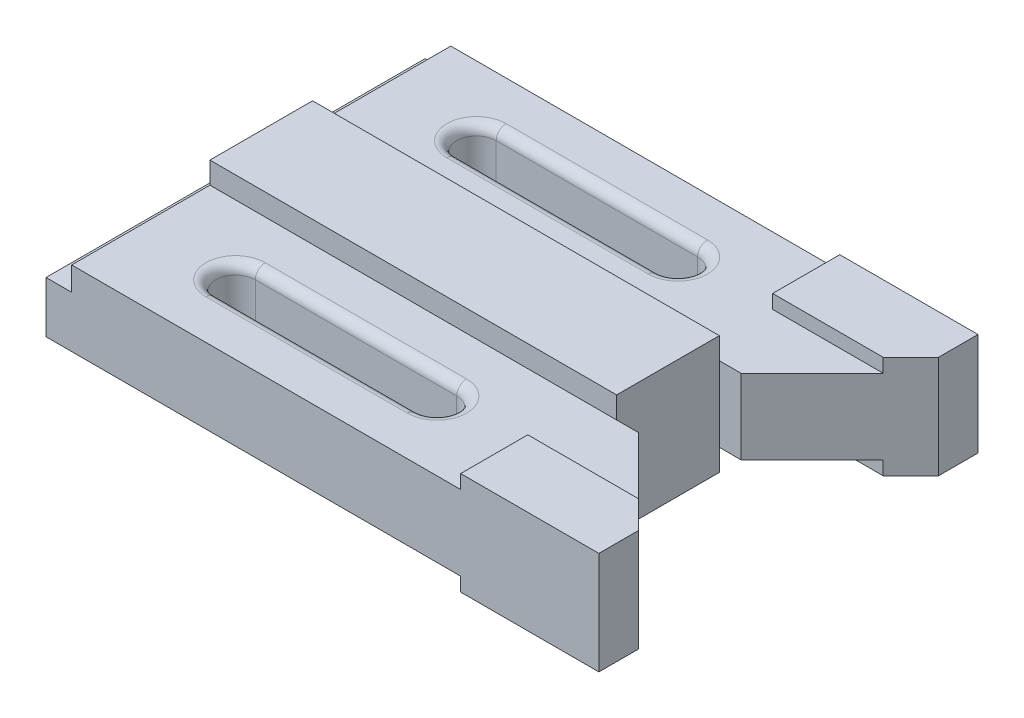
from build123d import *

# Parameters (mm, degrees)
SKETCH1_W           = 109.5
SKETCH1_H           = 26
BOSS_EXTRUDE2_DEPTH = 15
BOSS_EXTRUDE5_DEPTH = 9.5
BOSS_EXTRUDE6_DEPTH = 13
SKETCH2_W           = 6.5
SKETCH2_H           = 11.5
CUT_EXTRUDE1_DEPTH  = 171.414201286
FILLET1_R           = 2.5


with BuildPart() as part:
    # Sketch1 → Boss-Extrude2 (new, symmetric)
    with BuildSketch(Plane(origin=(0, 0, 0), x_dir=(1, 0, 0), z_dir=(0, 1, 0))):
        with Locations((54.75, 0)):
            Rectangle(SKETCH1_W, SKETCH1_H)
    extrude(amount=BOSS_EXTRUDE2_DEPTH, both=True)

    # Sketch1<6> → Boss-Extrude5 (add, symmetric)
    # profile 1 of 2: a face of its own
    with BuildSketch(Plane(origin=(0, 0, 0), x_dir=(1, 0, 0), z_dir=(0, 1, 0))):
        Polygon((0, -30.5), (0, -48), (105, -48), (105, -31), (133, -31), (115, -13), (0, -13), align=None)
        with BuildLine():
            ThreePointArc((30.5, -35.5), (26.964466094, -34.035533906), (25.5, -30.5))
            ThreePointArc((25.5, -30.5), (26.964466094, -26.964466094), (30.5, -25.5))
            Line((30.5, -25.5), (81.5, -25.5))
            ThreePointArc((81.5, -25.5), (86.5, -30.5), (81.5, -35.5))
            Line((81.5, -35.5), (30.5, -35.5))
        make_face(mode=Mode.SUBTRACT)
    # profile 2 of 2: a face of its own
    with BuildSketch(Plane(origin=(0, 0, 0), x_dir=(1, 0, 0), z_dir=(0, 1, 0))):
        Polygon((0, 30.5), (0, 13), (115, 13), (133, 31), (105, 31), (105, 48), (0, 48), align=None)
        with BuildLine():
            ThreePointArc((30.5, 25.5), (26.964466094, 26.964466094), (25.5, 30.5))
            ThreePointArc((25.5, 30.5), (26.964466094, 34.035533906), (30.5, 35.5))
            Line((30.5, 35.5), (81.5, 35.5))
            ThreePointArc((81.5, 35.5), (86.5, 30.5), (81.5, 25.5))
            Line((81.5, 25.5), (30.5, 25.5))
        make_face(mode=Mode.SUBTRACT)
    extrude(amount=BOSS_EXTRUDE5_DEPTH, both=True)

    # Sketch1<7> → Boss-Extrude6 (add, symmetric)
    with BuildSketch(Plane(origin=(0, 0, 0), x_dir=(1, 0, 0), z_dir=(0, 1, 0))):
        Polygon((105, -31), (105, -48), (140, -48), (140, -38), (133, -31), align=None)
        Polygon((140, 48), (105, 48), (105, 31), (133, 31), (140, 38), align=None)
    extrude(amount=BOSS_EXTRUDE6_DEPTH, both=True)

    # Sketch2 → Cut-Extrude1 (cut, through all)
    with BuildSketch(Plane(origin=(0, 0, -48), x_dir=(-1, 0, 0), z_dir=(0, 0, -1))):
        with Locations((-3.25, 9.25)):
            Rectangle(SKETCH2_W, SKETCH2_H)
    extrude(amount=-CUT_EXTRUDE1_DEPTH, mode=Mode.SUBTRACT)

    # Fillet1
    fillet1_edges = [part.edges().sort_by_distance(p)[0] for p in [
        (56, 9.5, 25.5),
        (56, -9.5, 25.5),
        (25.5, 9.5, 30.5),
        (25.5, -9.5, 30.5),
        (86.5, 9.5, 30.5),
        (86.5, -9.5, 30.5),
        (56, 9.5, 35.5),
        (56, -9.5, 35.5),
        (56, 9.5, -25.5),
        (56, -9.5, -25.5),
        (86.5, 9.5, -30.5),
        (86.5, -9.5, -30.5),
        (25.5, 9.5, -30.5),
        (25.5, -9.5, -30.5),
        (56, 9.5, -35.5),
        (56, -9.5, -35.5),
    ]]
    fillet(fillet1_edges, radius=FILLET1_R)


solid = part.part
